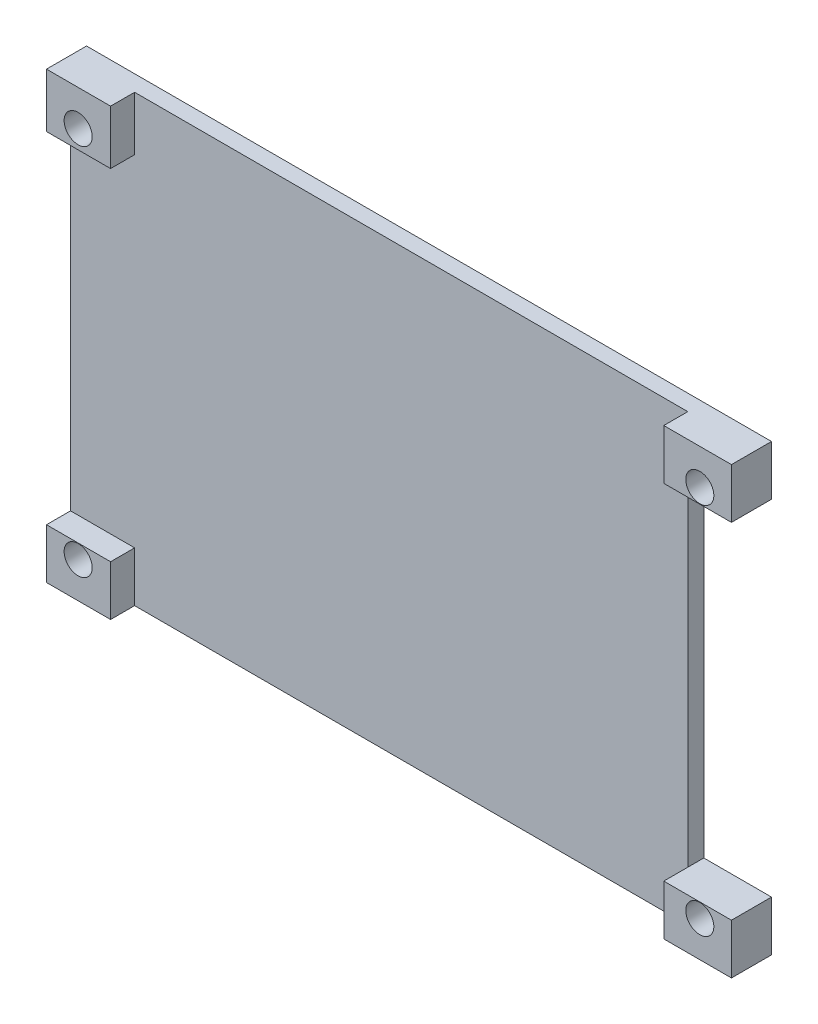
from build123d import *

# Parameters (mm, degrees)
SKETCH_1_R      = 1.75
EXTRUDE_1_DEPTH = 2
SKETCH_3_W      = 8
SKETCH_3_H      = 6.75
SKETCH_3_R      = 1.75
SKETCH_3_H_2    = 6.25
SKETCH_3_W_2    = 8.45
EXTRUDE_2_DEPTH = 3


with BuildPart() as part:
    # 草图1 → 凸台-拉伸1 (new body)
    with BuildSketch(Plane.XY):
        Polygon((85.5, 49.25), (77.05, 49.25), (77.05, 6.25), (85.5, 6.25), (85.5, 0), (0, 0), (0, 55.5), (85.5, 55.5), align=None)
        with Locations((3.95, 51.05)):
            Circle(SKETCH_1_R, mode=Mode.SUBTRACT)
        with Locations((81.55, 51.05)):
            Circle(SKETCH_1_R, mode=Mode.SUBTRACT)
        with Locations((3.95, 4.45)):
            Circle(SKETCH_1_R, mode=Mode.SUBTRACT)
        with Locations((81.55, 4.45)):
            Circle(SKETCH_1_R, mode=Mode.SUBTRACT)
    extrude(amount=EXTRUDE_1_DEPTH)

    # 草图3 → 凸台-拉伸2 (add)
    # profile 1 of 4: a face of its own
    with BuildSketch(Plane.XY.offset(2)):
        with Locations((4, 52.125)):
            Rectangle(SKETCH_3_W, SKETCH_3_H)
        with Locations((3.95, 51.05)):
            Circle(SKETCH_3_R, mode=Mode.SUBTRACT)
    # profile 2 of 4: a face of its own
    with BuildSketch(Plane.XY.offset(2)):
        with Locations((4, 3.125)):
            Rectangle(SKETCH_3_W, SKETCH_3_H_2)
        with Locations((3.95, 4.45)):
            Circle(SKETCH_3_R, mode=Mode.SUBTRACT)
    # profile 3 of 4: a face of its own
    with BuildSketch(Plane.XY.offset(2)):
        with Locations((81.275, 52.375)):
            Rectangle(SKETCH_3_W_2, SKETCH_3_H_2)
        with Locations((81.55, 51.05)):
            Circle(SKETCH_3_R, mode=Mode.SUBTRACT)
    # profile 4 of 4: a face of its own
    with BuildSketch(Plane.XY.offset(2)):
        with Locations((81.275, 3.125)):
            Rectangle(SKETCH_3_W_2, SKETCH_3_H_2)
        with Locations((81.55, 4.45)):
            Circle(SKETCH_3_R, mode=Mode.SUBTRACT)
    extrude(amount=EXTRUDE_2_DEPTH)


solid = part.part
